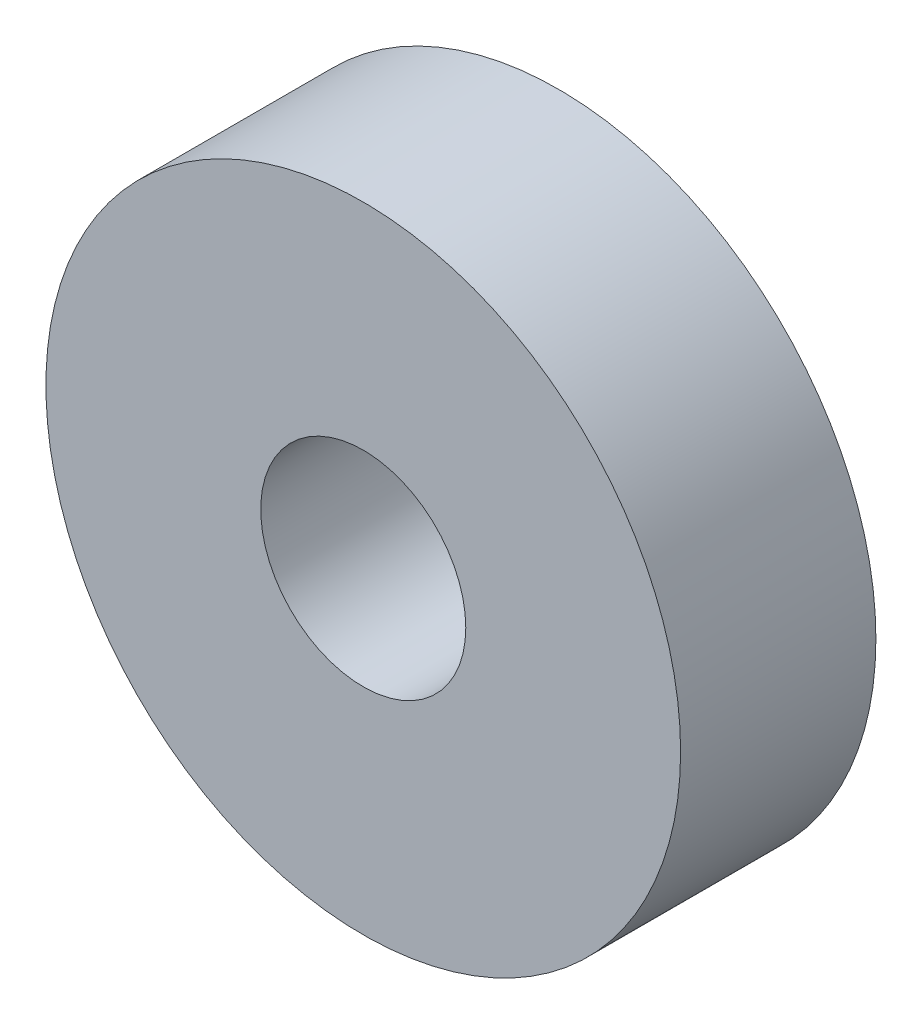
from build123d import *

# Parameters (mm, degrees)
SKETCH1_R           = 6.5
SKETCH1_R_2         = 2.1
BOSS_EXTRUDE1_DEPTH = 4


with BuildPart() as part:
    # Sketch1 → Boss-Extrude1 (new body)
    with BuildSketch(Plane.XY):
        Circle(SKETCH1_R)
        Circle(SKETCH1_R_2, mode=Mode.SUBTRACT)
    extrude(amount=BOSS_EXTRUDE1_DEPTH)


solid = part.part
